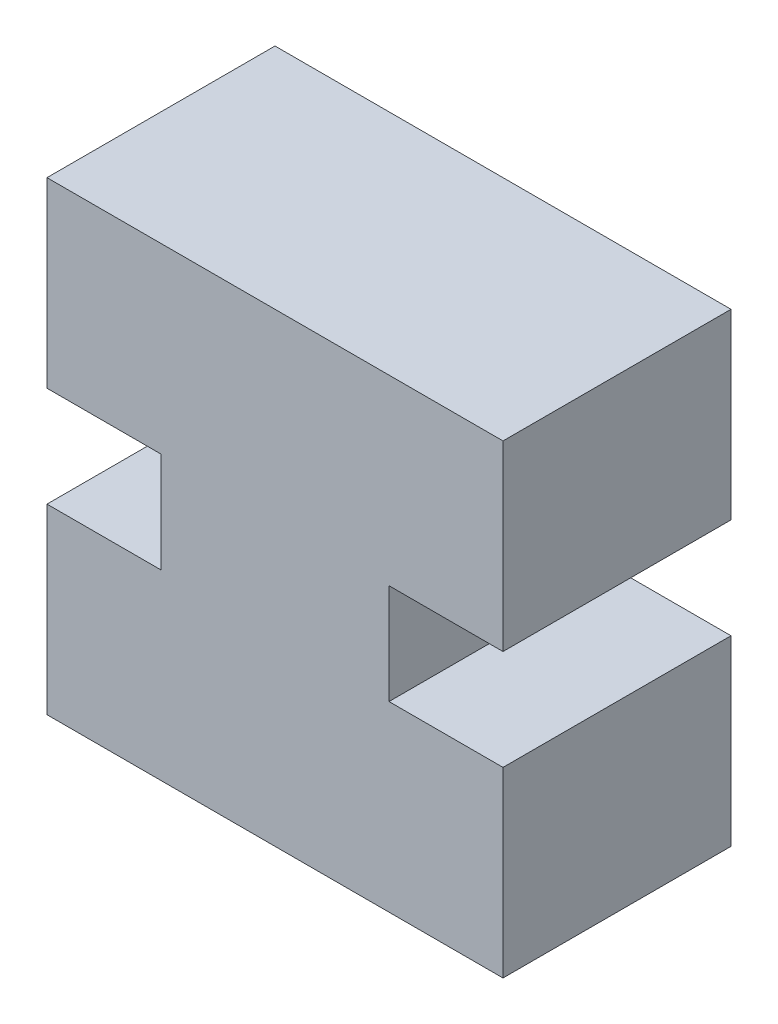
from build123d import *

# Parameters (mm, degrees)
BOSS_EXTRUDE1_DEPTH = 6.35


with BuildPart() as part:
    # Sketch2 → Boss-Extrude1 (new body)
    with BuildSketch(Plane.XY):
        Polygon((0, 0), (12.7, 0), (12.7, -5.08), (9.525, -5.08), (9.525, -7.874), (12.7, -7.874), (12.7, -12.954), (0, -12.954), (0, -7.874), (3.175, -7.874), (3.175, -5.08), (0, -5.08), align=None)
    extrude(amount=BOSS_EXTRUDE1_DEPTH)


solid = part.part
